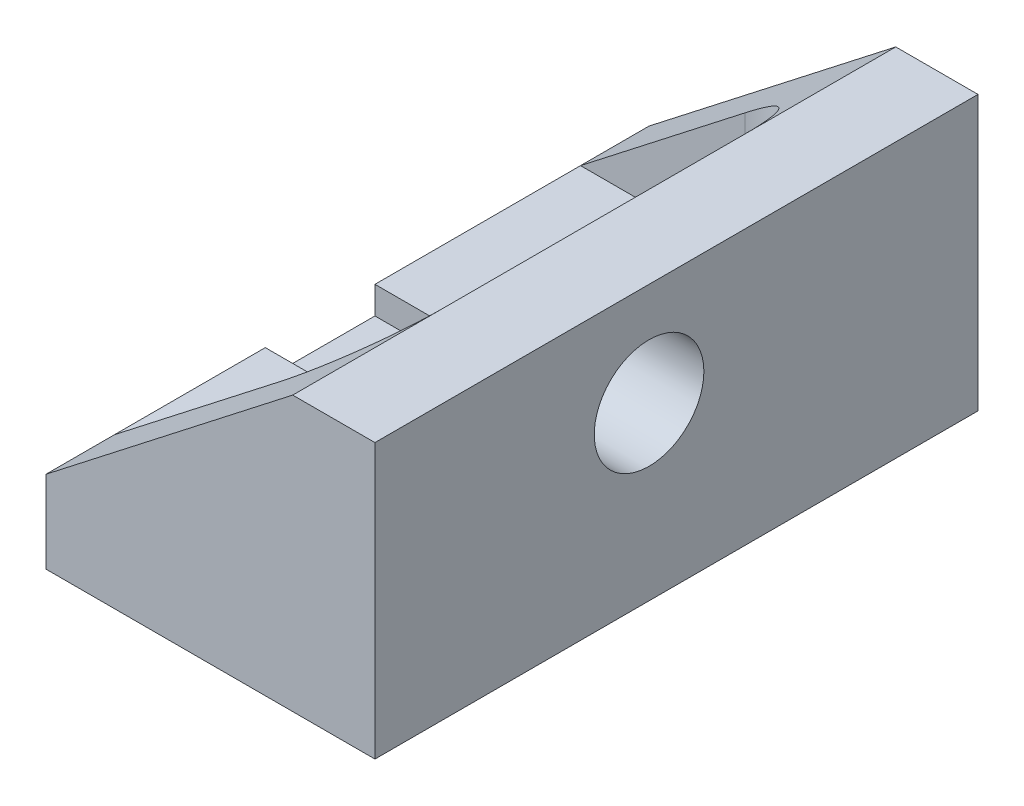
from build123d import *

# Parameters (mm, degrees)
SKETCH_1_R          = 1.35
EXTRUDE_1_DEPTH     = 3
SKETCH_2_W          = 3
SKETCH_2_H          = 22
EXTRUDE_2_DEPTH     = 7
SKETCH_3_R          = 2
CUT_EXTRUDE_2_DEPTH = 20.104973175
EXTRUDE_3_DEPTH     = 2.5
FILLET_1_R          = 3
CUT_EXTRUDE_3_DEPTH = 1


with BuildPart() as part:
    # 草图1 → 凸台-拉伸1 (new body)
    with BuildSketch(Plane(origin=(0, 0, 0), x_dir=(1, 0, 0), z_dir=(0, 1, 0))):
        Polygon((-4, -11), (4, -11), (8, -11), (8, 11), (4, 11), (-4, 11), align=None)
        with Locations((0, 6)):
            Circle(SKETCH_1_R, mode=Mode.SUBTRACT)
        with Locations((0, -6)):
            Circle(SKETCH_1_R, mode=Mode.SUBTRACT)
    extrude(amount=EXTRUDE_1_DEPTH)

    # 草图2 → 凸台-拉伸2 (add)
    with BuildSketch(Plane(origin=(0, 3, 0), x_dir=(1, 0, 0), z_dir=(0, 1, 0))):
        with Locations((6.5, 0)):
            Rectangle(SKETCH_2_W, SKETCH_2_H)
    extrude(amount=EXTRUDE_2_DEPTH)

    # 草图3 → 切除-拉伸2 (cut, through all)
    with BuildSketch(Plane(origin=(8, 0, 0), x_dir=(0, 0, -1), z_dir=(1, 0, 0))):
        with Locations((-1, 6.25)):
            Circle(SKETCH_3_R)
    extrude(amount=-CUT_EXTRUDE_2_DEPTH, mode=Mode.SUBTRACT)

    # 草图4 → 凸台-拉伸3 (add)
    with BuildSketch(Plane(origin=(0, 0, -11), x_dir=(-1, 0, 0), z_dir=(0, 0, -1))):
        Polygon((-5, 10), (-5, 3), (4, 3), align=None)
    extrude_3 = extrude(amount=-EXTRUDE_3_DEPTH)

    # 镜向1: 凸台-拉伸3 across plane
    add(extrude_3.mirror(Plane.XY))

    # 圆角1
    fillet_1_edges = [part.edges().sort_by_distance(p)[0] for p in [
        (5, 6.5, 8.5),
        (5, 6.5, -8.5),
    ]]
    fillet(fillet_1_edges, radius=FILLET_1_R)

    # 草图5 → 切除-拉伸3 (cut)
    with BuildSketch(Plane(origin=(0, 3, 0), x_dir=(1, 0, 0), z_dir=(0, 1, 0))):
        Polygon((1.5, 2.25), (5, 2.25), (5, -4.25), (1.5, -4.25), (1.5, -3), (-4, -3), (-4, 1), (1.5, 1), align=None)
    extrude(amount=-CUT_EXTRUDE_3_DEPTH, mode=Mode.SUBTRACT)


solid = part.part
